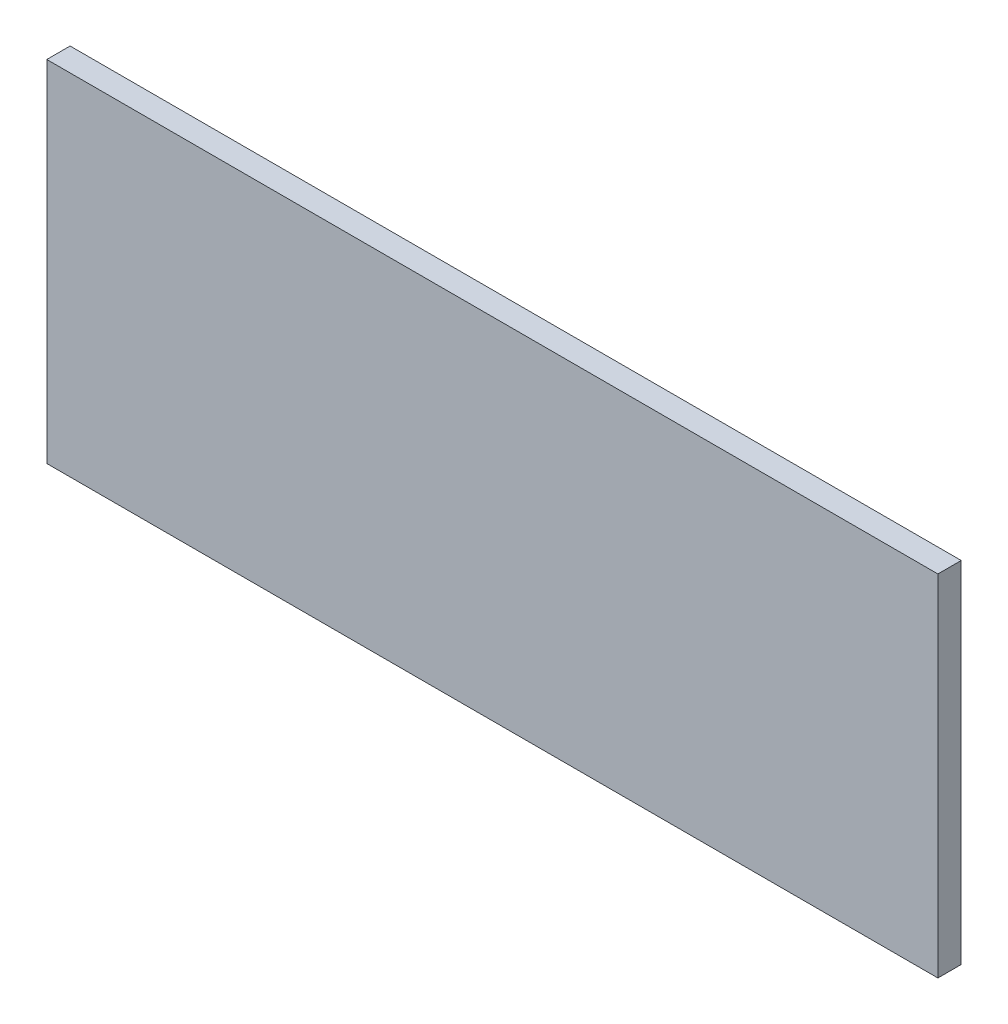
from build123d import *

# Parameters (mm, degrees)
SKETCH1_W           = 382
SKETCH1_H           = 150
BOSS_EXTRUDE1_DEPTH = 10


with BuildPart() as part:
    # Sketch1 → Boss-Extrude1 (new body)
    with BuildSketch(Plane.XY):
        Rectangle(SKETCH1_W, SKETCH1_H)
    extrude(amount=BOSS_EXTRUDE1_DEPTH)


solid = part.part
